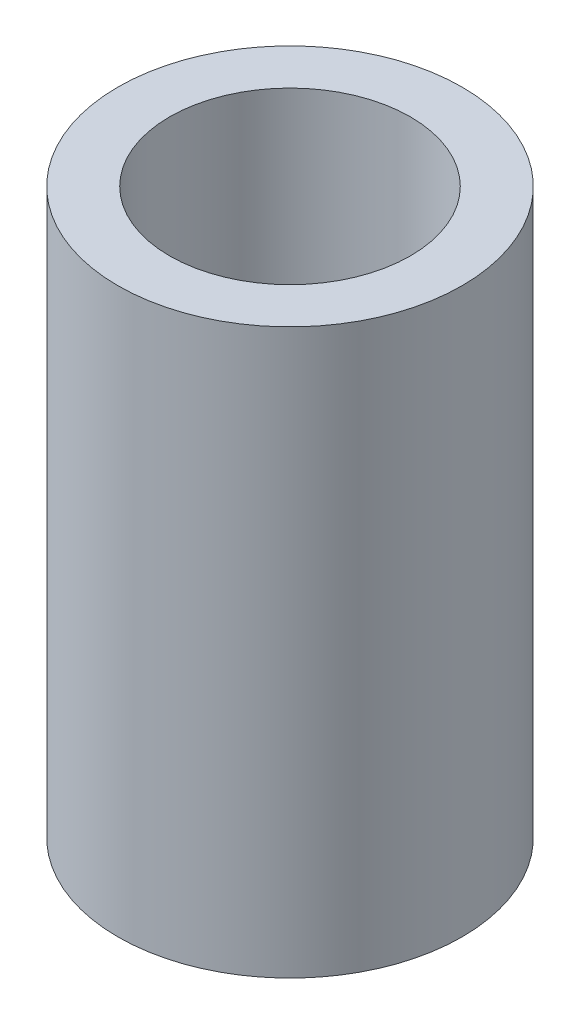
from build123d import *

# Parameters (mm, degrees)
SKETCH1_R           = 2.8575
SKETCH1_R_2         = 2
BOSS_EXTRUDE1_DEPTH = 9.36625


with BuildPart() as part:
    # Sketch1 → Boss-Extrude1 (new body)
    with BuildSketch(Plane(origin=(0, 0, 0), x_dir=(1, 0, 0), z_dir=(0, 1, 0))):
        with Locations(Location((0, 0, 0), (0, 0, 270))):
            Circle(SKETCH1_R)
        with Locations(Location((0, 0, 0), (0, 0, 270))):
            Circle(SKETCH1_R_2, mode=Mode.SUBTRACT)
    extrude(amount=-BOSS_EXTRUDE1_DEPTH)


solid = part.part
